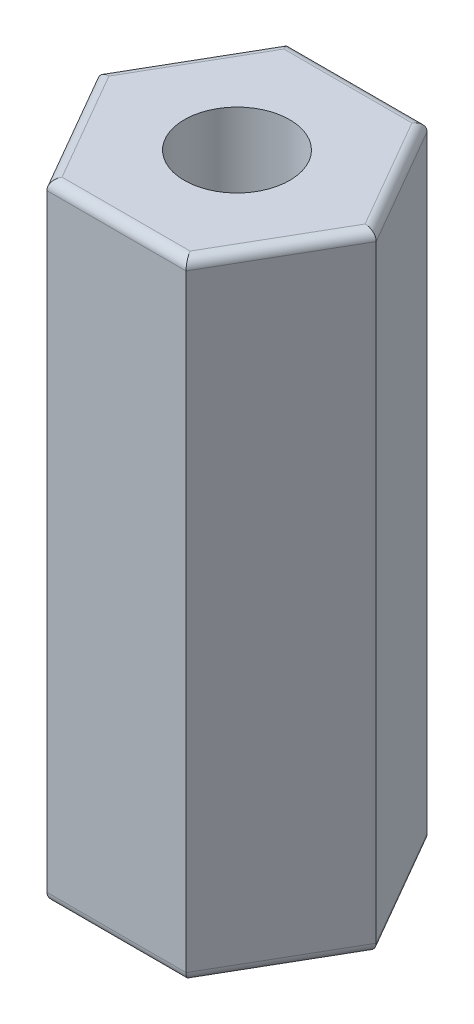
from build123d import *

# Parameters (mm, degrees)
RESSALTO_EXTRUS_O1_DEPTH = 13
FILETE1_R                = 0.2
ESBO_O3_R                = 1.0922
CORTE_EXTRUS_O1_DEPTH    = 5
CORTE_EXTRUS_O2_START    = -5
ESBO_O2_R                = 1.0922
CORTE_EXTRUS_O2_DEPTH    = 5


with BuildPart() as part:
    # Esboço1 → Ressalto-extrusão1 (new body)
    with BuildSketch(Plane(origin=(0, 0, 0), x_dir=(1, 0, 0), z_dir=(0, 1, 0))):
        Polygon((2.886751346, 0), (1.443375673, 2.5), (-1.443375673, 2.5), (-2.886751346, 0), (-1.443375673, -2.5), (1.443375673, -2.5), align=None)
    extrude(amount=RESSALTO_EXTRUS_O1_DEPTH)

    # Filete1
    filete1_edges = [part.edges().sort_by_distance(p)[0] for p in [
        (0, 13, -2.5),
        (-2.165063509, 13, -1.25),
        (-2.165063509, 13, 1.25),
        (0, 13, 2.5),
        (2.165063509, 13, 1.25),
        (0, 0, 2.5),
        (-2.165063509, 0, 1.25),
        (-2.165063509, 0, -1.25),
        (2.165063509, 13, -1.25),
        (0, 0, -2.5),
        (2.165063509, 0, -1.25),
        (2.165063509, 0, 1.25),
    ]]
    fillet(filete1_edges, radius=FILETE1_R)

    # Esboço3 → Corte-extrusão1 (cut)
    with BuildSketch(Plane(origin=(0, 13, 0), x_dir=(1, 0, 0), z_dir=(0, 1, 0))):
        with Locations(Location((0, 0, 0), (0, 0, 270))):
            Circle(ESBO_O3_R)
    extrude(amount=-CORTE_EXTRUS_O1_DEPTH, mode=Mode.SUBTRACT)

    # Esboço2 → Corte-extrusão2 (cut)
    with BuildSketch(Plane.XZ.offset(CORTE_EXTRUS_O2_START)):
        with Locations(Location((0, 0, 0), (0, 0, 90))):
            Circle(ESBO_O2_R)
    extrude(amount=CORTE_EXTRUS_O2_DEPTH, mode=Mode.SUBTRACT)


solid = part.part
